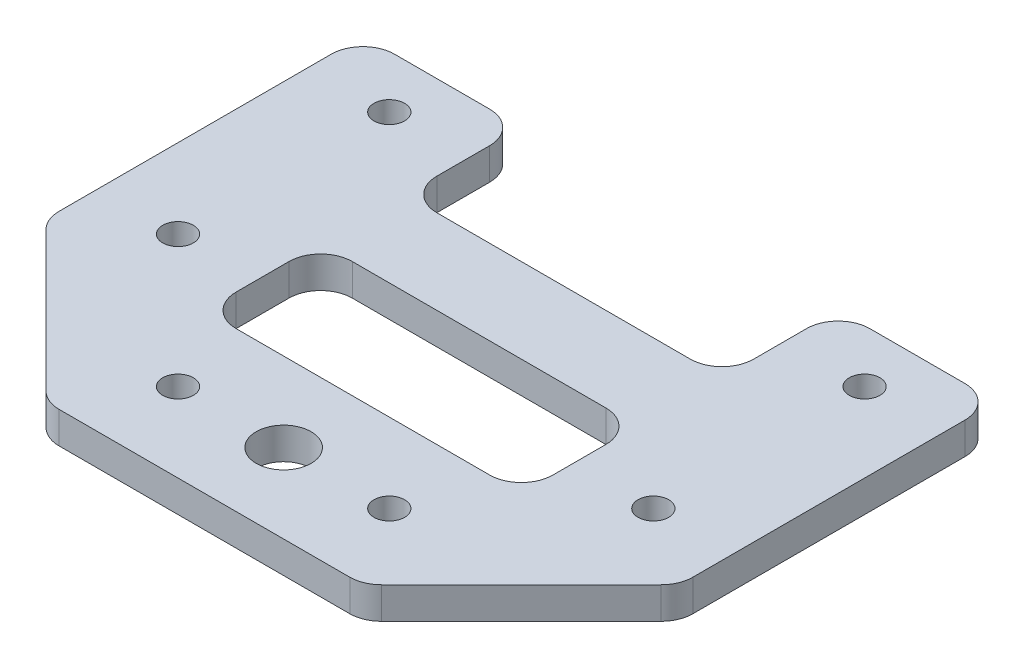
from build123d import *

# Parameters (mm, degrees)
SKETCH_1_W          = 30
SKETCH_1_H          = 20
EXTRUDE_1_DEPTH     = 3
SKETCH_2_R          = 1.6
CUT_EXTRUDE_1_DEPTH = 19.275666882
SKETCH_3_W          = 15
SKETCH_3_H          = 30
SKETCH_3_R          = 1.45
EXTRUDE_2_DEPTH     = 3
SKETCH_4_W          = 30
SKETCH_4_H          = 6
CUT_EXTRUDE_2_DEPTH = 34.674916481
SKETCH_5_R          = 1.45
SKETCH_5_R_2        = 2.6
EXTRUDE_3_DEPTH     = 3
CUT_EXTRUDE_3_DEPTH = 43.532340636
FILLET_1_R          = 3


with BuildPart() as part:
    # 草图1 → 凸台-拉伸1 (new body)
    with BuildSketch(Plane(origin=(0, 0, 0), x_dir=(1, 0, 0), z_dir=(0, 1, 0))):
        Rectangle(SKETCH_1_W, SKETCH_1_H)
    extrude(amount=EXTRUDE_1_DEPTH)

    # 草图2 → 切除-拉伸1 (cut, through all)
    with BuildSketch(Plane(origin=(0, 3, 0), x_dir=(1, 0, 0), z_dir=(0, 1, 0))):
        with Locations(Location((-5, 7.5, 0), (0, 0, 270))):
            Circle(SKETCH_2_R)
        with Locations(Location((5, 7.5, 0), (0, 0, 270))):
            Circle(SKETCH_2_R)
        with Locations(Location((5, -7.5, 0), (0, 0, 270))):
            Circle(SKETCH_2_R)
        with Locations(Location((-5, -7.5, 0), (0, 0, 270))):
            Circle(SKETCH_2_R)
    extrude(amount=-CUT_EXTRUDE_1_DEPTH, mode=Mode.SUBTRACT)

    # 草图3 → 凸台-拉伸2 (add)
    # profile 1 of 2: a face of its own
    with BuildSketch(Plane(origin=(0, 3, 0), x_dir=(1, 0, 0), z_dir=(0, 1, 0))):
        with Locations((22.5, 0)):
            Rectangle(SKETCH_3_W, SKETCH_3_H)
        with Locations(Location((22.5, -10, 0), (0, 0, 90))):
            Circle(SKETCH_3_R, mode=Mode.SUBTRACT)
        with Locations(Location((22.5, 10, 0), (0, 0, 90))):
            Circle(SKETCH_3_R, mode=Mode.SUBTRACT)
    # profile 2 of 2: a face of its own
    with BuildSketch(Plane(origin=(0, 3, 0), x_dir=(1, 0, 0), z_dir=(0, 1, 0))):
        with Locations((-22.5, 0)):
            Rectangle(SKETCH_3_W, SKETCH_3_H)
        with Locations(Location((-22.5, 10, 0), (0, 0, 270))):
            Circle(SKETCH_3_R, mode=Mode.SUBTRACT)
        with Locations(Location((-22.5, -10, 0), (0, 0, 270))):
            Circle(SKETCH_3_R, mode=Mode.SUBTRACT)
    extrude(amount=-EXTRUDE_2_DEPTH)

    # 草图4 → 切除-拉伸2 (cut, through all)
    with BuildSketch(Plane.XZ):
        with Locations((0, 7)):
            Rectangle(SKETCH_4_W, SKETCH_4_H)
        with Locations((0, -7)):
            Rectangle(SKETCH_4_W, SKETCH_4_H)
    extrude(amount=-CUT_EXTRUDE_2_DEPTH, mode=Mode.SUBTRACT)

    # 草图5 → 凸台-拉伸3 (add)
    with BuildSketch(Plane(origin=(0, 3, 0), x_dir=(1, 0, 0), z_dir=(0, 1, 0))):
        Polygon((30, -15), (15, -15), (-15, -15), (-30, -15), (-30, -30), (30, -30), align=None)
        with Locations(Location((-10, -22.5, 0), (0, 0, 270))):
            Circle(SKETCH_5_R, mode=Mode.SUBTRACT)
        with Locations(Location((0, -22.5, 0), (0, 0, 270))):
            Circle(SKETCH_5_R_2, mode=Mode.SUBTRACT)
        with Locations(Location((10, -22.5, 0), (0, 0, 270))):
            Circle(SKETCH_5_R, mode=Mode.SUBTRACT)
    extrude(amount=-EXTRUDE_3_DEPTH)

    # 草图6 → 切除-拉伸3 (cut, through all)
    with BuildSketch(Plane(origin=(0, 3, 0), x_dir=(1, 0, 0), z_dir=(0, 1, 0))):
        Polygon((-30, -15), (-15, -30), (-30, -30), align=None)
        Polygon((30, -30), (30, -15), (15, -30), align=None)
    extrude(amount=-CUT_EXTRUDE_3_DEPTH, mode=Mode.SUBTRACT)

    # 圆角1
    fillet_1_edges = [part.edges().sort_by_distance(p)[0] for p in [
        (-30, 1.5, 15),
        (-15, 1.5, 30),
        (15, 1.5, 30),
        (30, 1.5, 15),
        (15, 1.5, 15),
        (15, 1.5, -15),
        (30, 1.5, -15),
        (-15, 1.5, -15),
        (-15, 1.5, 15),
        (-30, 1.5, -15),
        (-15, 1.5, 4),
        (15, 1.5, 4),
        (-15, 1.5, -4),
        (15, 1.5, -4),
    ]]
    fillet(fillet_1_edges, radius=FILLET_1_R)


solid = part.part
